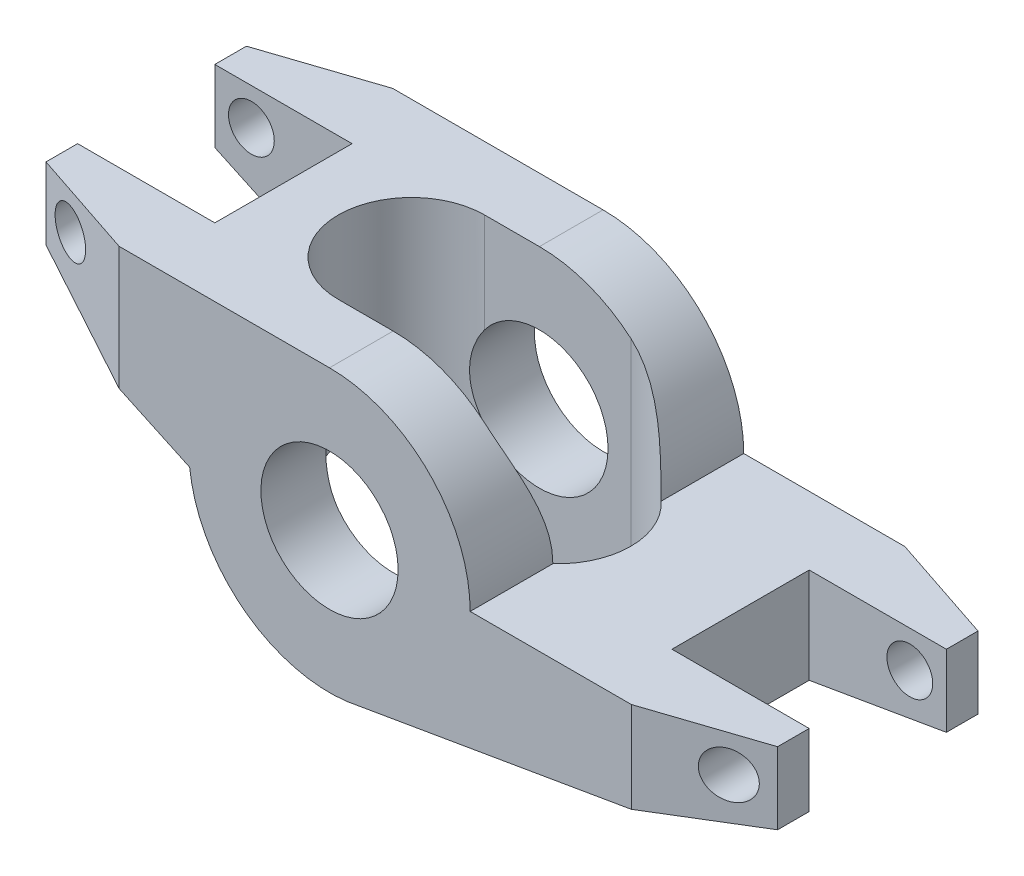
from build123d import *
from OCP.BRepFilletAPI import BRepFilletAPI_MakeChamfer

# Parameters (mm, degrees)
SKETCH1_R               = 4.765
BOSS_EXTRUDE1_DEPTH     = 9.5
CHAMFER5_SIZE           = 7.62
CHAMFER5_SIZE2          = 2.54
CHAMFER6_SIZE           = 2.54
CHAMFER6_SIZE2          = 7.62
SKETCH2_W               = 9.53
SKETCH2_H               = 9.53
CUT_EXTRUDE1_DEPTH      = 32.662585176
SKETCH2_2_W             = 9.53
SKETCH2_2_H             = 9.53
CUT_EXTRUDE2_DEPTH      = 32.662585176
CUT_EXTRUDE3_DEPTH      = 32.662585176
CUT_EXTRUDE3_DEPTH_BACK = 32.662585176
CUT_EXTRUDE4_DEPTH      = 32.662585236
CUT_EXTRUDE4_DEPTH_BACK = 32.662585236
SKETCH4_R               = 1.59


with BuildPart() as part:
    # Sketch1 → Boss-Extrude1 (new, symmetric)
    with BuildSketch(Plane.XY):
        with BuildLine():
            Line((0, 9.77), (-22.23, 9.77))
            Line((-22.23, 9.77), (-22.23, 4.77))
            Line((-22.23, 4.77), (-9.711509246, -1.067468107))
            ThreePointArc((-9.711509246, -1.067468107), (-5.694059685, -7.939180329), (2.103028838, -9.540973206))
            Line((2.103028838, -9.540973206), (28.58, -5))
            Line((28.58, -5), (28.58, 0))
            Line((28.58, 0), (9.77, 0))
            ThreePointArc((9.77, 0), (6.908433252, 6.908433252), (0, 9.77))
        make_face()
        Circle(SKETCH1_R, mode=Mode.SUBTRACT)
    extrude(amount=BOSS_EXTRUDE1_DEPTH, both=True)

    # Chamfer5
    chamfer5_edges = [part.edges().sort_by_distance(p)[0] for p in [
        (28.58, -2.5, -9.5),
        (-22.23, 7.27, -9.5),
    ]]
    chamfer5_side = [part.faces().sort_by_distance(p)[0] for p in [
        (6.52350029, 6.52350029, -9.5),
    ]]
    chamfer(chamfer5_edges, length=CHAMFER5_SIZE, length2=CHAMFER5_SIZE2, reference=chamfer5_side[0])

    # Chamfer6: one chamfer whose edges measure the first distance from different faces: ONE call of the kernel's chamfer builder (chamfer() names one face for all edges)
    chamfer6_edges_1 = [part.edges().sort_by_distance(p)[0] for p in [
        (28.58, -2.5, 9.5),
    ]]
    chamfer6_side_1 = [part.faces().sort_by_distance(p)[0] for p in [
        (28.58, -2.5, 1.27),
    ]]
    chamfer6_edges_2 = [part.edges().sort_by_distance(p)[0] for p in [
        (-22.23, 7.27, 9.5),
    ]]
    chamfer6_side_2 = [part.faces().sort_by_distance(p)[0] for p in [
        (-22.23, 7.27, 1.27),
    ]]
    chamfer6 = BRepFilletAPI_MakeChamfer(part.part.solid().wrapped)
    for e in chamfer6_edges_1:
        chamfer6.Add(CHAMFER6_SIZE, CHAMFER6_SIZE2, e.wrapped, chamfer6_side_1[0].wrapped)  # the first distance lies on this face
    for e in chamfer6_edges_2:
        chamfer6.Add(CHAMFER6_SIZE, CHAMFER6_SIZE2, e.wrapped, chamfer6_side_2[0].wrapped)  # the first distance lies on this face
    add(Compound.cast(chamfer6.Shape()), mode=Mode.REPLACE)

    # Sketch2 → Cut-Extrude1 (cut, through all)
    with BuildSketch(Plane(origin=(0, 0, 0), x_dir=(1, 0, 0), z_dir=(0, 1, 0))):
        with Locations((-17.465, 0)):
            Rectangle(SKETCH2_W, SKETCH2_H)
        with Locations((23.815, 0)):
            Rectangle(SKETCH2_W, SKETCH2_H)
    extrude(amount=-CUT_EXTRUDE1_DEPTH, mode=Mode.SUBTRACT)

    # Sketch2<2> → Cut-Extrude2 (cut, through all)
    with BuildSketch(Plane(origin=(0, 0, 0), x_dir=(1, 0, 0), z_dir=(0, 1, 0))):
        with Locations((-17.465, 0)):
            Rectangle(SKETCH2_2_W, SKETCH2_2_H)
        with Locations((23.815, 0)):
            Rectangle(SKETCH2_2_W, SKETCH2_2_H)
    extrude(amount=CUT_EXTRUDE2_DEPTH, mode=Mode.SUBTRACT)

    # Sketch3 → Cut-Extrude3 (cut, two sides: drawn at the far end of the back side and taken through both)
    with BuildSketch(Plane(origin=(0, 0, 0), x_dir=(1, 0, 0), z_dir=(0, 1, 0)).offset(-CUT_EXTRUDE3_DEPTH_BACK)):
        with BuildLine():
            Line((-3.81, 5.08), (6.35, 5.08))
            ThreePointArc((6.35, 5.08), (11.43, 0), (6.35, -5.08))
            Line((6.35, -5.08), (-3.81, -5.08))
            ThreePointArc((-3.81, -5.08), (-8.89, 0), (-3.81, 5.08))
        make_face()
    extrude(amount=CUT_EXTRUDE3_DEPTH + CUT_EXTRUDE3_DEPTH_BACK, mode=Mode.SUBTRACT)

    # Sketch4 → Cut-Extrude4 (cut, two sides: drawn at the far end of the back side and taken through both)
    with BuildSketch(Plane.XY.offset(-CUT_EXTRUDE4_DEPTH_BACK)):
        with Locations((-19.69, 7.23)):
            Circle(SKETCH4_R)
        with Locations((26.04, -2.54)):
            Circle(SKETCH4_R)
    extrude(amount=CUT_EXTRUDE4_DEPTH + CUT_EXTRUDE4_DEPTH_BACK, mode=Mode.SUBTRACT)


solid = part.part
